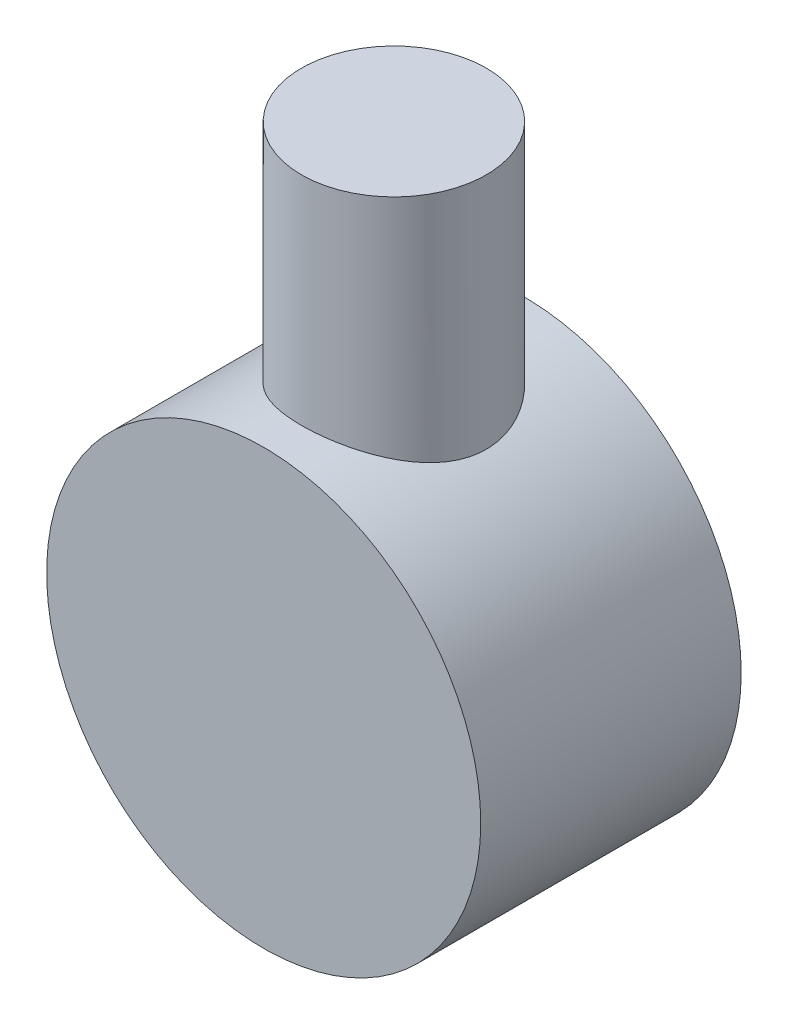
from build123d import *

# Parameters (mm, degrees)
SKETCH1_R           = 25
BOSS_EXTRUDE1_DEPTH = 15
SKETCH2_R           = 10.65
BOSS_EXTRUDE2_DEPTH = 50


with BuildPart() as part:
    # Sketch1 → Boss-Extrude1 (new, symmetric)
    with BuildSketch(Plane.XY):
        Circle(SKETCH1_R)
    extrude(amount=BOSS_EXTRUDE1_DEPTH, both=True)

    # Sketch2 → Boss-Extrude2 (add)
    with BuildSketch(Plane(origin=(0, 0, 0), x_dir=(1, 0, 0), z_dir=(0, 1, 0))):
        with Locations(Location((0, 0, 0), (0, 0, 90))):
            Circle(SKETCH2_R)
    extrude(amount=BOSS_EXTRUDE2_DEPTH)


solid = part.part
